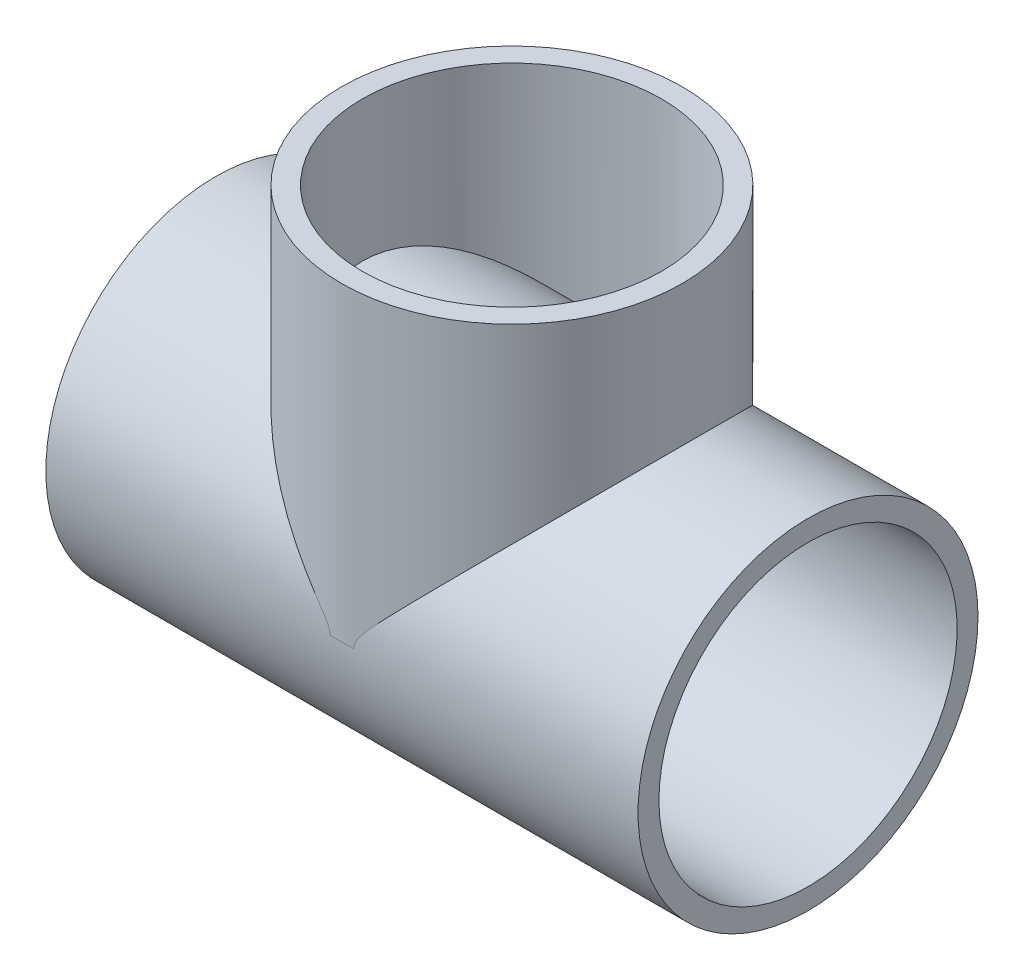
from build123d import *
from build123d.topology import SkipClean

# Parameters (mm, degrees)
CROQUIS1_R              = 65.15
CROQUIS1_R_2            = 57.15
SALIENTE_EXTRUIR1_DEPTH = 227
CROQUIS2_R              = 65.308818862
CROQUIS2_R_2            = 57.308818862
SALIENTE_EXTRUIR2_DEPTH = 119
CROQUIS3_R              = 57.15
CORTAR_EXTRUIR1_DEPTH   = 227


with BuildPart() as part:
    # Croquis1 → Saliente-Extruir1 (new body)
    with BuildSketch(Plane(origin=(0, 0, 0), x_dir=(0, 0, -1), z_dir=(1, 0, 0))):
        with Locations(Location((0, 0, 0), (0, 0, 180))):
            Circle(CROQUIS1_R)
        with Locations(Location((0, 0, 0), (0, 0, 180))):
            Circle(CROQUIS1_R_2, mode=Mode.SUBTRACT)
    extrude(amount=SALIENTE_EXTRUIR1_DEPTH)

    # Croquis2 → Saliente-Extruir2 (add)
    with BuildSketch(Plane(origin=(0, 0, 0), x_dir=(1, 0, 0), z_dir=(0, 1, 0))):
        with Locations(Location((113.5, 0, 0), (0, 0, 86.003398893))):
            Circle(CROQUIS2_R)
        with Locations(Location((113.5, 0, 0), (0, 0, 90))):
            Circle(CROQUIS2_R_2, mode=Mode.SUBTRACT)
    extrude(amount=SALIENTE_EXTRUIR2_DEPTH)

    # Croquis3 → Cortar-Extruir1 (cut)
    with SkipClean():  # the faces are left unmerged after this step: merging them gives an invalid solid
        with BuildSketch(Plane.ZY):
            Circle(CROQUIS3_R)
        extrude(amount=-CORTAR_EXTRUIR1_DEPTH, mode=Mode.SUBTRACT)


solid = part.part
